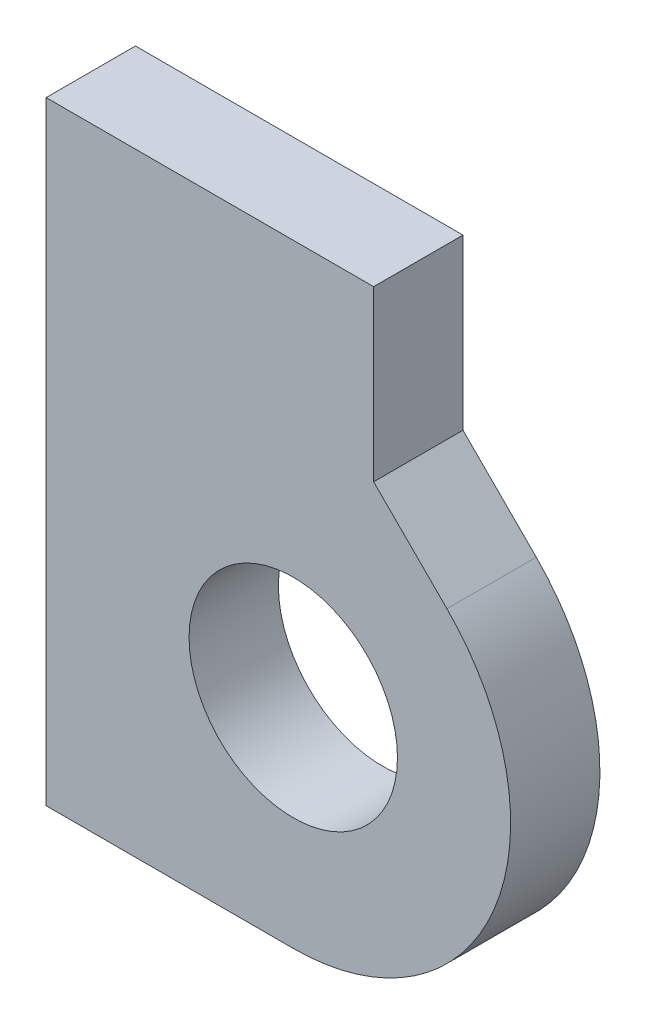
from build123d import *

# Parameters (mm, degrees)
SKETCH_1_R      = 35
EXTRUDE_1_DEPTH = 30


with BuildPart() as part:
    # 草图1 → 凸台-拉伸1 (new body)
    with BuildSketch(Plane.XY):
        with BuildLine():
            Line((0, 0), (110, 0))
            Line((110, 0), (110, -56.762409947))
            Line((110, -56.762409947), (134.618795027, -81.381204973))
            ThreePointArc((134.618795027, -81.381204973), (150.443205873, -160.935890563), (83, -206))
            Line((83, -206), (0, -206))
            Line((0, -206), (0, 0))
        make_face()
        with Locations((83, -133)):
            Circle(SKETCH_1_R, mode=Mode.SUBTRACT)
    extrude(amount=EXTRUDE_1_DEPTH)


solid = part.part
